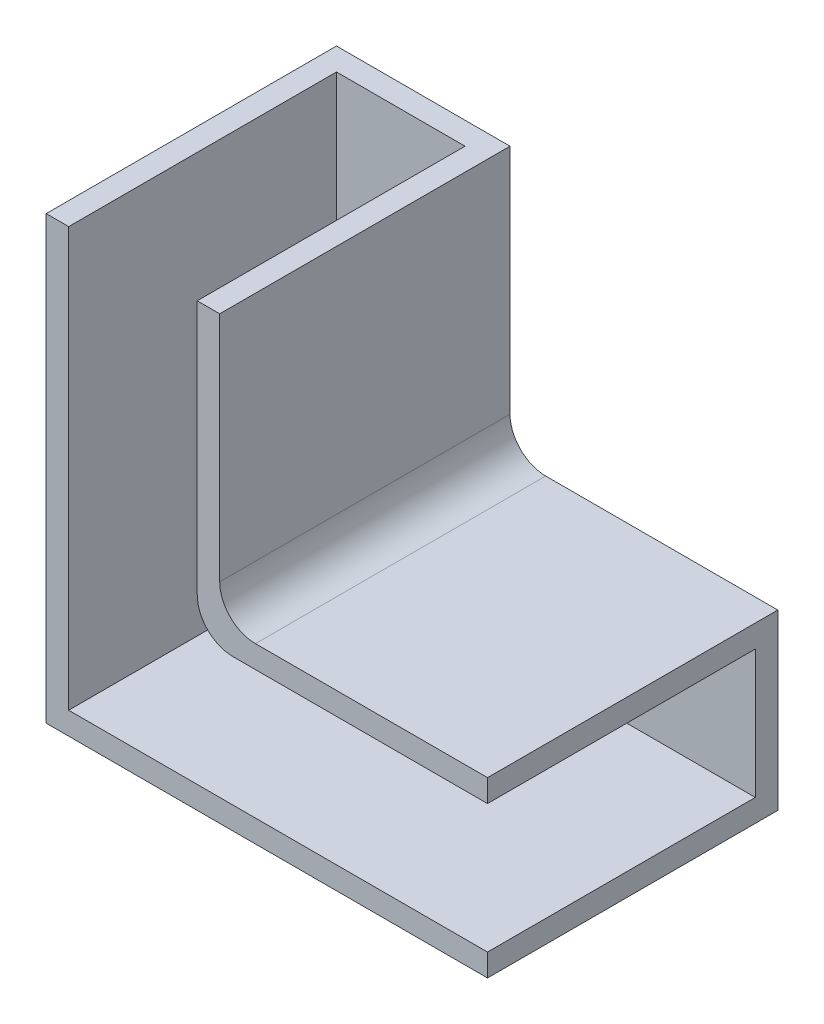
from build123d import *

# Parameters (mm, degrees)
BOSS_EXTRUDE1_DEPTH = 0.8
BOSS_EXTRUDE2_DEPTH = 9.525
FILLET1_R           = 1.27


with BuildPart() as part:
    # Sketch1 → Boss-Extrude1 (new body)
    with BuildSketch(Plane.XY):
        Polygon((0, 0), (0, 15.697000102), (6.172000102, 15.697000102), (6.172000102, 6.172000102), (15.697000102, 6.172000102), (15.697000102, 0), align=None)
    extrude(amount=BOSS_EXTRUDE1_DEPTH)

    # Sketch2 → Boss-Extrude2 (add)
    with BuildSketch(Plane.XY.offset(0.8)):
        Polygon((0.8, 0.8), (15.697000102, 0.8), (15.697000102, 0), (0, 0), (0, 15.697000102), (0.8, 15.697000102), align=None)
        Polygon((15.697000102, 5.372000102), (5.372000102, 5.372000102), (5.372000102, 15.697000102), (6.172000102, 15.697000102), (6.172000102, 6.172000102), (15.697000102, 6.172000102), align=None)
    extrude(amount=BOSS_EXTRUDE2_DEPTH)

    # Fillet1
    fillet1_edges = [part.edges().sort_by_distance(p)[0] for p in [
        (6.172000102, 6.172000102, 5.1625),
        (5.372000102, 5.372000102, 5.5625),
    ]]
    fillet(fillet1_edges, radius=FILLET1_R)


solid = part.part
